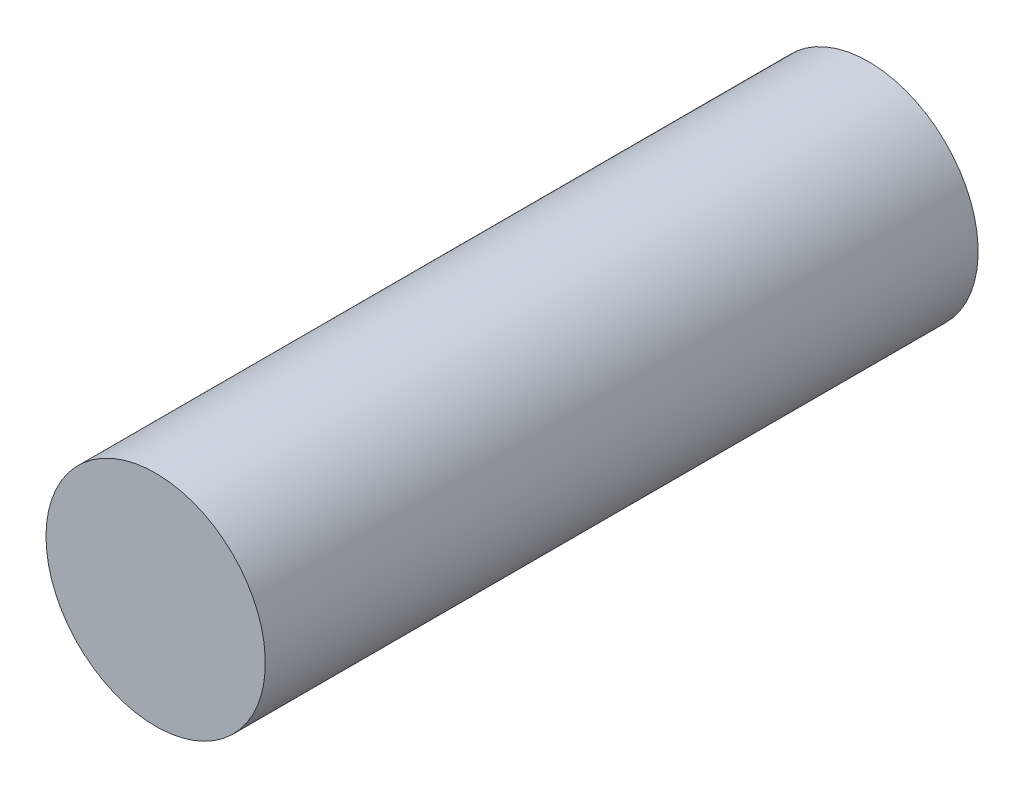
from build123d import *

# Parameters (mm, degrees)
SKETCH1_R           = 8
BOSS_EXTRUDE1_DEPTH = 26


with BuildPart() as part:
    # Sketch1 → Boss-Extrude1 (new, symmetric)
    with BuildSketch(Plane.XY):
        with Locations(Location((0, 0, 0), (0, 0, 180))):
            Circle(SKETCH1_R)
    extrude(amount=BOSS_EXTRUDE1_DEPTH, both=True)


solid = part.part
